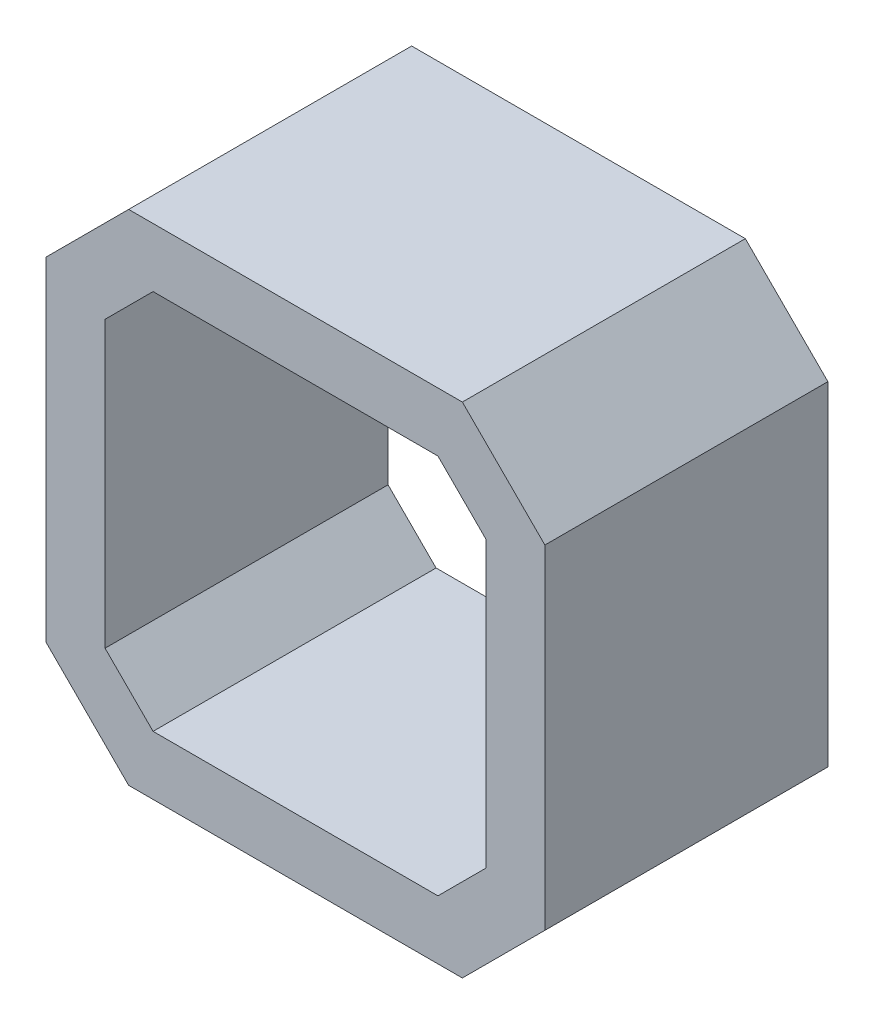
from build123d import *

# Parameters (mm, degrees)
BOSS_EXTRUDE1_DEPTH = 24


with BuildPart() as part:
    # Sketch1 → Boss-Extrude1 (new body)
    with BuildSketch(Plane.XY):
        Polygon((-14.15, 21.15), (-21.15, 14.15), (-21.15, -14.15), (-14.15, -21.15), (14.15, -21.15), (21.15, -14.15), (21.15, 14.15), (14.15, 21.15), align=None)
        Polygon((12.078932188, 16.15), (-12.078932188, 16.15), (-16.15, 12.078932188), (-16.15, -12.078932188), (-12.078932188, -16.15), (12.078932188, -16.15), (16.15, -12.078932188), (16.15, 12.078932188), align=None, mode=Mode.SUBTRACT)
    extrude(amount=BOSS_EXTRUDE1_DEPTH)


solid = part.part
